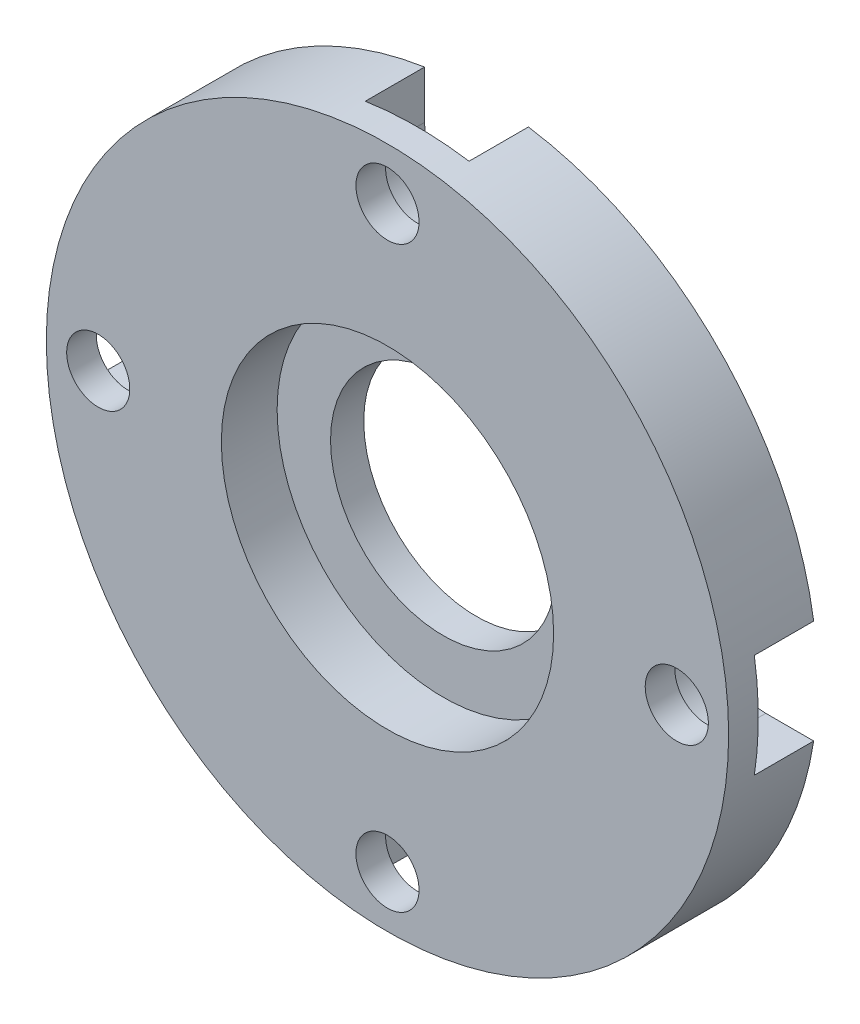
from build123d import *

# Parameters (mm, degrees)
CBORE_FOR_1_4_SOCKET_HEAD_CAP_SCREW1_D           = 6.7564
CBORE_FOR_1_4_SOCKET_HEAD_CAP_SCREW1_CBORE_D     = 11.1125
CBORE_FOR_1_4_SOCKET_HEAD_CAP_SCREW1_CBORE_DEPTH = 6.35
CUT_EXTRUDE1_DEPTH                               = 6.35


with BuildPart() as part:
    # Cap → Endcap-Revolve (revolve)
    with BuildSketch(Plane(origin=(0, 0, 0), x_dir=(0, 0, -1), z_dir=(1, 0, 0)), mode=Mode.PRIVATE) as endcap_revolve_sk:
        Polygon((93.345, 12.065), (89.789, 12.065), (89.789, 17.78), (83.82, 17.78), (83.82, 36.5125), (93.345, 36.5125), align=None)
    revolve(endcap_revolve_sk.sketch.rotate(Axis((0, 0, -141.5522592), (0, 0, 1)), 90), axis=Axis((0, 0, -141.5522592), (0, 0, 1)))

    # CBORE for 1/4 Socket Head Cap Screw1 (through all)
    with Locations(Plane(origin=(0, 0, -93.345), x_dir=(-1, 0, 0), z_dir=(0, 0, -1))):
        with Locations((0, 30.95752), (30.95752, 0), (0, -30.95752), (-30.95752, 0)):
            CounterBoreHole(CBORE_FOR_1_4_SOCKET_HEAD_CAP_SCREW1_D / 2, CBORE_FOR_1_4_SOCKET_HEAD_CAP_SCREW1_CBORE_D / 2, CBORE_FOR_1_4_SOCKET_HEAD_CAP_SCREW1_CBORE_DEPTH)

    # Bolt-Clearance → Cut-Extrude1 (cut)
    with BuildSketch(Plane(origin=(0, 0, -93.345), x_dir=(-1, 0, 0), z_dir=(0, 0, -1))):
        Polygon((5.55625, 30.95752), (5.55625, 37.30752), (-5.55625, 37.30752), (-5.55625, 30.95752), (0, 30.95752), align=None)
        Polygon((30.95752, 0), (30.95752, 5.55625), (37.30752, 5.55625), (37.30752, -5.55625), (30.95752, -5.55625), align=None)
        Polygon((0, -30.95752), (5.55625, -30.95752), (5.55625, -37.30752), (-5.55625, -37.30752), (-5.55625, -30.95752), align=None)
        Polygon((-30.95752, 0), (-30.95752, -5.55625), (-37.30752, -5.55625), (-37.30752, 5.55625), (-30.95752, 5.55625), align=None)
    extrude(amount=-CUT_EXTRUDE1_DEPTH, mode=Mode.SUBTRACT)


solid = part.part
